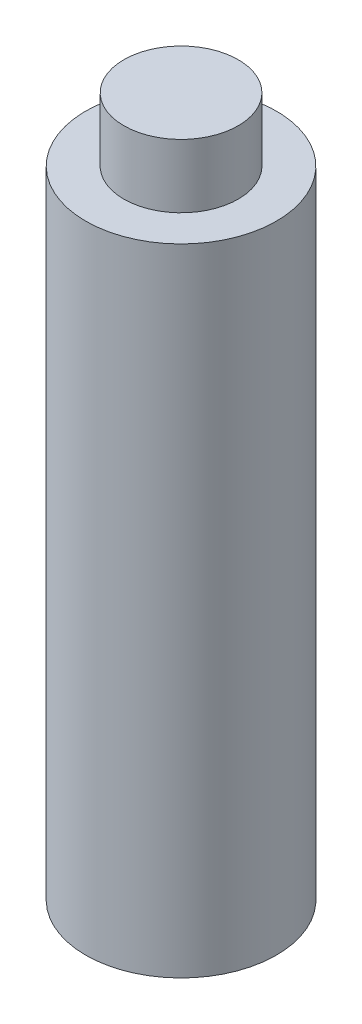
from build123d import *

# Parameters (mm, degrees)
SKETCH1_R           = 7.5
BOSS_EXTRUDE1_DEPTH = 50
SKETCH2_R           = 4.5
BOSS_EXTRUDE2_DEPTH = 5


with BuildPart() as part:
    # Sketch1 → Boss-Extrude1 (new body)
    with BuildSketch(Plane(origin=(0, 0, 0), x_dir=(1, 0, 0), z_dir=(0, 1, 0))):
        with Locations(Location((0, 0, 0), (0, 0, 270))):
            Circle(SKETCH1_R)
    extrude(amount=BOSS_EXTRUDE1_DEPTH)

    # Sketch2 → Boss-Extrude2 (add)
    with BuildSketch(Plane(origin=(0, 50, 0), x_dir=(1, 0, 0), z_dir=(0, 1, 0))):
        with Locations(Location((0, 0, 0), (0, 0, 270))):
            Circle(SKETCH2_R)
    extrude(amount=BOSS_EXTRUDE2_DEPTH)


solid = part.part
